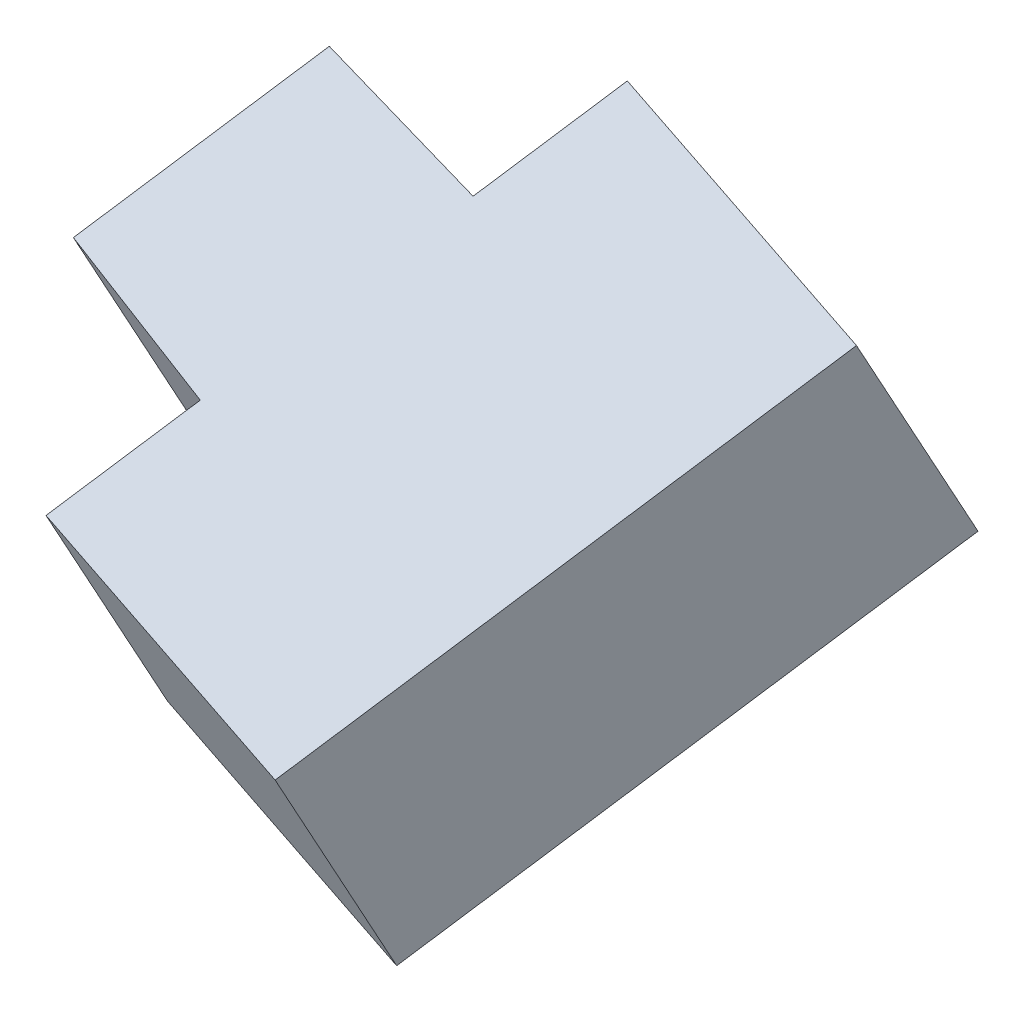
from build123d import *

# Parameters (mm, degrees)
BOSS_EXTRUDE1_DEPTH = 3


with BuildPart() as part:
    # Sketch1 → Boss-Extrude1 (new, symmetric)
    with BuildSketch(Plane(origin=(-30.283899698, 190.565141588, 90.851699095), x_dir=(0.9895658040523138, 0.13875740324000221, 0.03880595954733255), z_dir=(-0.14199461682965575, 0.8935184877292665, 0.42598385048896426))):
        Polygon((8.563747727, 165.135393036), (10.279333672, 164.577962648), (5.822293392, 150.860670181), (-3.840436305, 154.00029672), (-2.657796412, 157.640070264), (-8.299385893, 159.693450084), (-6.337119306, 165.732656145), (-0.566035918, 164.077815643), (0.616603976, 167.717589188), align=None)
    extrude(amount=BOSS_EXTRUDE1_DEPTH, both=True)


solid = part.part
